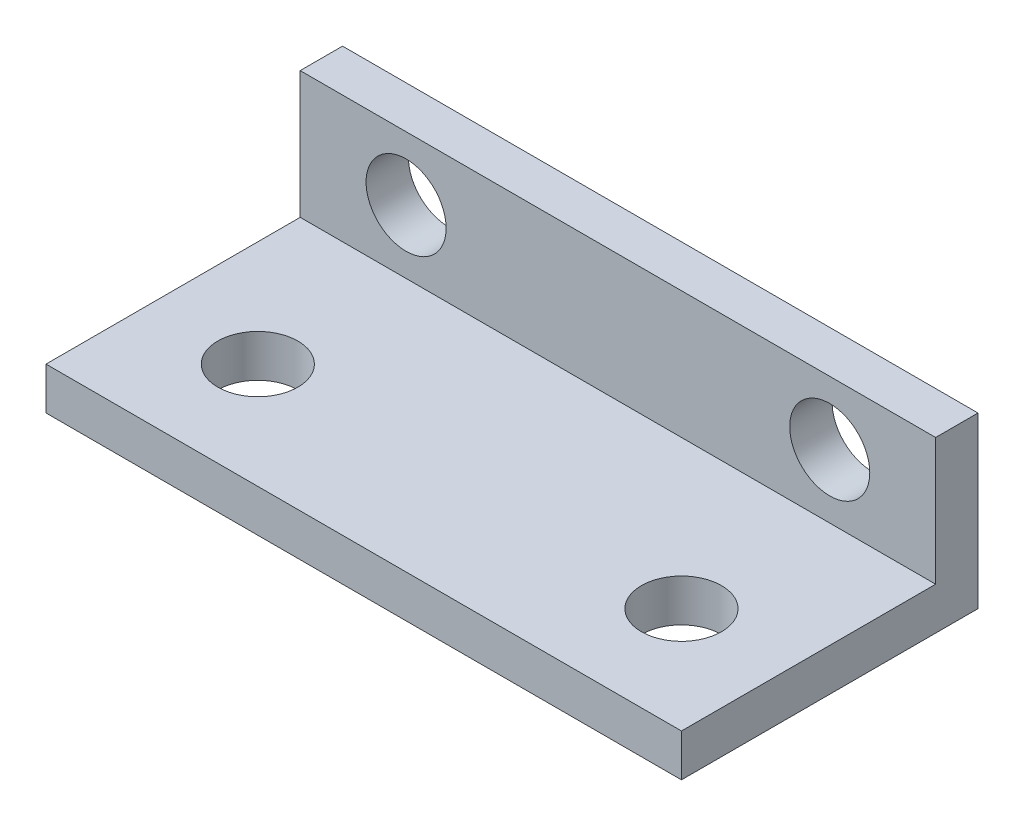
from build123d import *

# Parameters (mm, degrees)
SKETCH2_W               = 10.16
SKETCH2_H               = 10.16
BOSS_EXTRUDE1_DEPTH     = 38.1
CUT_EXTRUDE1_DEPTH      = 41.719297636
CUT_EXTRUDE1_DEPTH_BACK = 38.1
SKETCH3_W               = 7.62
SKETCH3_H               = 7.62
M4_CLEARANCE_HOLE2_D    = 4.8
SKETCH13_W              = 38.1
SKETCH13_H              = 2.54
BOSS_EXTRUDE2_DEPTH     = 7.62
M4_CLEARANCE_HOLE3_D    = 4.8


with BuildPart() as part:
    # Sketch2 → Boss-Extrude1 (new body)
    with BuildSketch(Plane(origin=(0, 0, 0), x_dir=(0, 0, -1), z_dir=(1, 0, 0))):
        with Locations((5.08, 5.08)):
            Rectangle(SKETCH2_W, SKETCH2_H)
    extrude(amount=BOSS_EXTRUDE1_DEPTH)

    # Sketch3 → Cut-Extrude1 (cut, two sides: drawn at the far end of the back side and taken through both)
    with BuildSketch(Plane(origin=(38.1, 0, 0), x_dir=(0, 0, -1), z_dir=(1, 0, 0)).offset(-CUT_EXTRUDE1_DEPTH_BACK)):
        with Locations((3.81, 6.35)):
            Rectangle(SKETCH3_W, SKETCH3_H)
    extrude(amount=CUT_EXTRUDE1_DEPTH + CUT_EXTRUDE1_DEPTH_BACK, mode=Mode.SUBTRACT)

    # M4 Clearance Hole2 (through all)
    with Locations(Plane.XY.offset(-7.62)):
        with Locations((6.35, 6.35), (31.75, 6.35)):
            Hole(M4_CLEARANCE_HOLE2_D / 2)

    # Sketch13 → Boss-Extrude2 (add)
    with BuildSketch(Plane.XY):
        with Locations((19.05, 1.27)):
            Rectangle(SKETCH13_W, SKETCH13_H)
    extrude(amount=BOSS_EXTRUDE2_DEPTH)

    # M4 Clearance Hole3 (through all)
    with Locations(Plane(origin=(0, 2.54, 0), x_dir=(1, 0, 0), z_dir=(0, 1, 0))):
        with Locations((6.35, -1.27), (31.75, -1.27)):
            Hole(M4_CLEARANCE_HOLE3_D / 2)


solid = part.part
